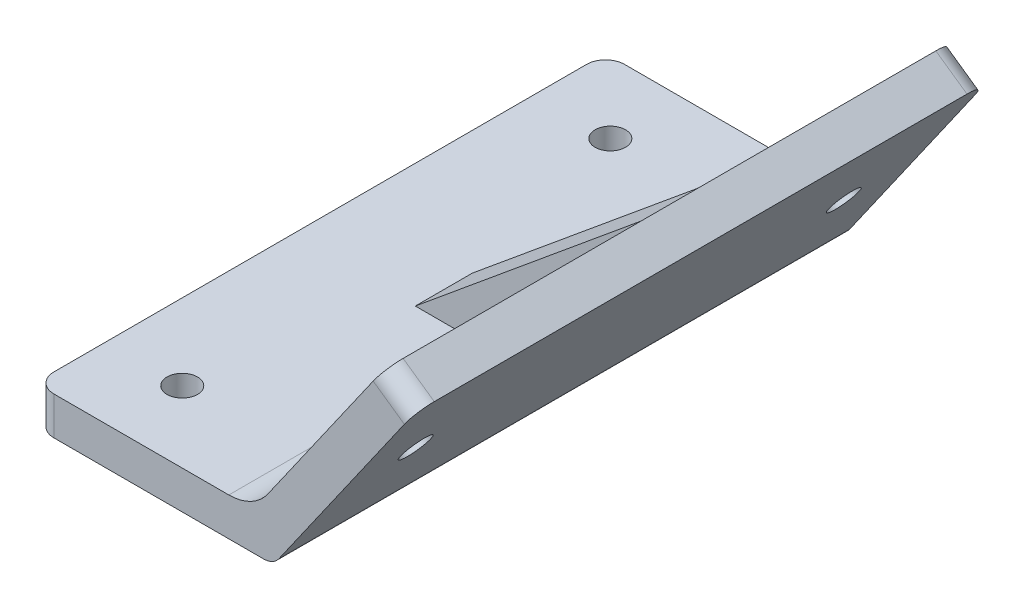
from build123d import *

# Parameters (mm, degrees)
BOSS_EXTRUDE1_DEPTH      = 30
BOSS_EXTRUDE1_DEPTH_BACK = 30
BOSS_EXTRUDE2_DEPTH      = 3
BOSS_EXTRUDE2_DEPTH_BACK = 3
SKETCH3_R                = 1.6
CUT_EXTRUDE1_DEPTH       = 47.598772642
SKETCH4_R                = 1.6
CUT_EXTRUDE2_DEPTH       = 46.1396211
FILLET1_R                = 5
FILLET2_R                = 2
FILLET3_R                = 2


with BuildPart() as part:
    # Sketch1 → Boss-Extrude1 (new, two sides: drawn at the far end of the back side and taken through both)
    with BuildSketch(Plane.XY.offset(-BOSS_EXTRUDE1_DEPTH_BACK)):
        Polygon((24.177513269, 21.592258897), (10.458865899, 2), (-12.541134101, 2), (-12.541134101, -2), (12.541134101, -2), (27.454121446, 19.297953152), align=None)
    extrude(amount=BOSS_EXTRUDE1_DEPTH + BOSS_EXTRUDE1_DEPTH_BACK)

    # Sketch2 → Boss-Extrude2 (add, two sides: drawn at the far end of the back side and taken through both)
    with BuildSketch(Plane.XY.offset(-BOSS_EXTRUDE2_DEPTH_BACK)):
        Polygon((10.458865899, 2), (24.177513269, 21.592258897), (0.458865899, 2), align=None)
    extrude(amount=BOSS_EXTRUDE2_DEPTH + BOSS_EXTRUDE2_DEPTH_BACK)

    # Sketch3 → Cut-Extrude1 (cut, through all)
    with BuildSketch(Plane(origin=(9.354919913, -6.550385442, 0), x_dir=(0, 0, -1), z_dir=(0.8191520442889935, -0.5735764363510437, 0))):
        with Locations((-22.5, 18.554994917)):
            Circle(SKETCH3_R)
        with Locations((22.5, 18.554994917)):
            Circle(SKETCH3_R)
    extrude(amount=-CUT_EXTRUDE1_DEPTH, mode=Mode.SUBTRACT)

    # Sketch4 → Cut-Extrude2 (cut, through all)
    with BuildSketch(Plane(origin=(0, 2, 0), x_dir=(1, 0, 0), z_dir=(0, 1, 0))):
        with Locations((-4.541134101, 22.5)):
            Circle(SKETCH4_R)
        with Locations((-4.541134101, -22.5)):
            Circle(SKETCH4_R)
    extrude(amount=-CUT_EXTRUDE2_DEPTH, mode=Mode.SUBTRACT)

    # Fillet1
    fillet1_edges = [part.edges().sort_by_distance(p)[0] for p in [
        (10.458865899, 2, 16.5),
        (10.458865899, 2, -16.5),
    ]]
    fillet(fillet1_edges, radius=FILLET1_R)

    # Fillet2
    fillet2_edges = [part.edges().sort_by_distance(p)[0] for p in [
        (25.815817358, 20.445106024, -30),
        (25.815817358, 20.445106024, 30),
        (12.541134101, -2, 0),
    ]]
    fillet(fillet2_edges, radius=FILLET2_R)

    # Fillet3
    fillet3_edges = [part.edges().sort_by_distance(p)[0] for p in [
        (-12.541134101, 0, -30),
        (-12.541134101, 0, 30),
    ]]
    fillet(fillet3_edges, radius=FILLET3_R)


solid = part.part
